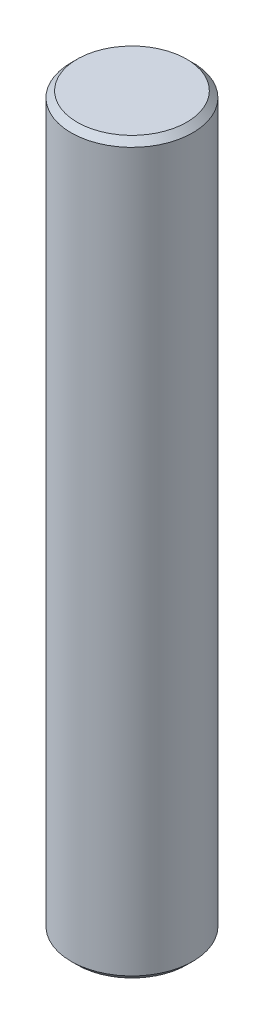
from build123d import *

# Parameters (mm, degrees)
SKETCH1_R           = 2.5
BOSS_EXTRUDE1_DEPTH = 15
CHAMFER1_SIZE       = 0.25


with BuildPart() as part:
    # Sketch1 → Boss-Extrude1 (new, symmetric)
    with BuildSketch(Plane(origin=(0, 0, 0), x_dir=(1, 0, 0), z_dir=(0, 1, 0))):
        with Locations(Location((0, 0, 0), (0, 0, 270))):
            Circle(SKETCH1_R)
    extrude(amount=BOSS_EXTRUDE1_DEPTH, both=True)

    # Chamfer1
    chamfer1_edges = [part.edges().sort_by_distance(p)[0] for p in [
        (0, -15, -2.5),
        (0, 15, -2.5),
    ]]
    chamfer(chamfer1_edges, length=CHAMFER1_SIZE)


solid = part.part
